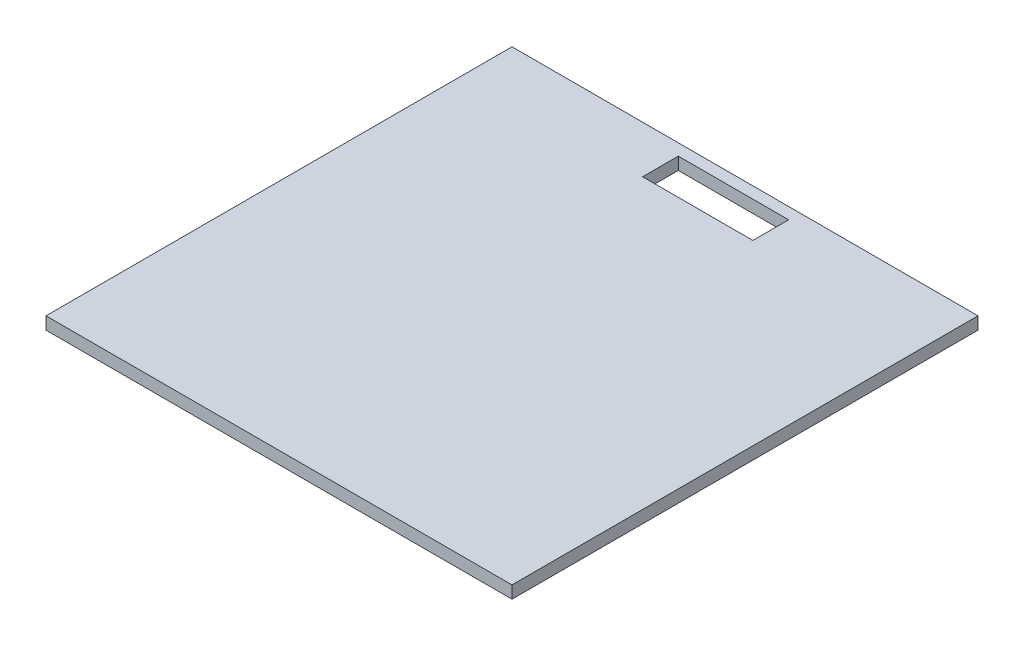
from build123d import *

# Parameters (mm, degrees)
SKETCH1_W           = 300
SKETCH1_H           = 300
SKETCH1_W_2         = 71
SKETCH1_H_2         = 23
BOSS_EXTRUDE1_DEPTH = 0.2
SKETCH1_3_W         = 300
SKETCH1_3_H         = 300
SKETCH1_3_W_2       = 71
SKETCH1_3_H_2       = 23
BOSS_EXTRUDE2_DEPTH = 8


with BuildPart() as part:
    # Sketch1 → Boss-Extrude1 (new body)
    with BuildSketch(Plane(origin=(0, 0, 0), x_dir=(1, 0, 0), z_dir=(0, 1, 0))):
        Rectangle(SKETCH1_W, SKETCH1_H)
        with Locations((0, 131.065800103)):
            Rectangle(SKETCH1_W_2, SKETCH1_H_2, mode=Mode.SUBTRACT)
    extrude(amount=BOSS_EXTRUDE1_DEPTH)

    # Sketch1<3> → Boss-Extrude2 (add)
    with BuildSketch(Plane(origin=(0, 0, 0), x_dir=(1, 0, 0), z_dir=(0, 1, 0))):
        Rectangle(SKETCH1_3_W, SKETCH1_3_H)
        with Locations((0, 131.065800103)):
            Rectangle(SKETCH1_3_W_2, SKETCH1_3_H_2, mode=Mode.SUBTRACT)
    extrude(amount=BOSS_EXTRUDE2_DEPTH)


solid = part.part
